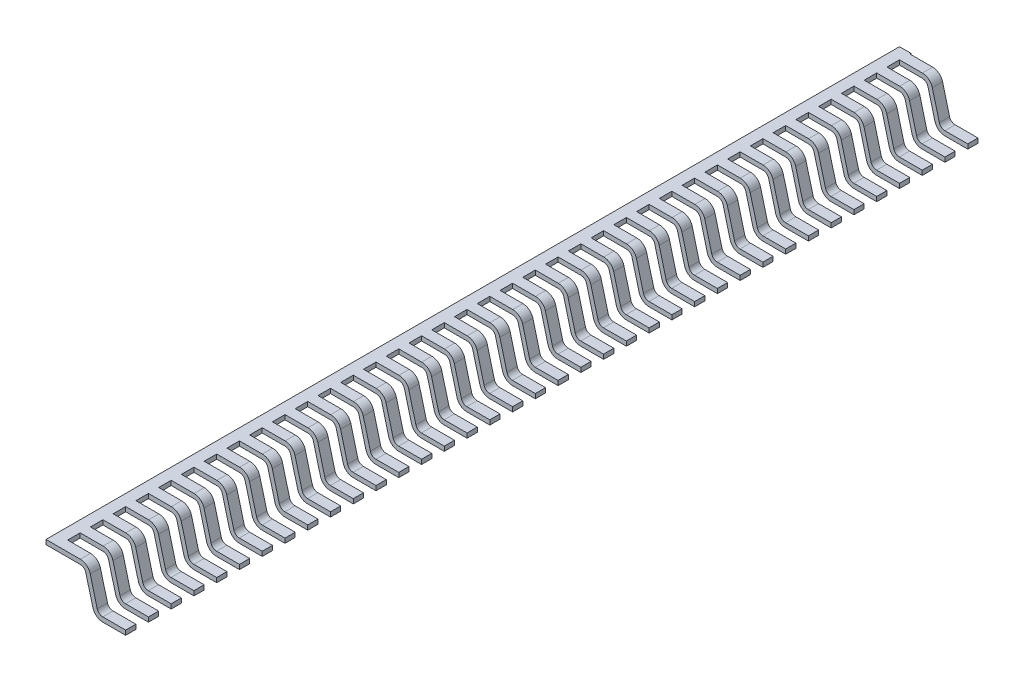
from build123d import *

# Parameters (mm, degrees)
EXTRUDE1_DEPTH  = 0.2286
SKETCH2_W       = 0.254
SKETCH2_H       = 19.05
EXTRUDE3_DEPTH  = 0.1016
LPATTERN2_COUNT = 38
LPATTERN2_PITCH = 0.508


with BuildPart() as part:
    # Sketch1 → Extrude1 (new body)
    with BuildSketch(Plane.XY):
        with BuildLine():
            Line((-0.127877099, 0.286320649), (0.029622326, -0.312177168))
            ThreePointArc((0.029622326, -0.312177168), (0.111127196, -0.435048696), (0.250695566, -0.4826))
            Line((0.250695566, -0.4826), (0.762, -0.4826))
            Line((0.762, -0.4826), (0.762, -0.381))
            Line((0.762, -0.381), (0.250695566, -0.381))
            ThreePointArc((0.250695566, -0.381), (0.173157583, -0.354582609), (0.127877099, -0.286320649))
            Line((0.127877099, -0.286320649), (-0.029622326, 0.312177168))
            ThreePointArc((-0.029622326, 0.312177168), (-0.111127196, 0.435048696), (-0.250695566, 0.4826))
            Line((-0.250695566, 0.4826), (-0.762, 0.4826))
            Line((-0.762, 0.4826), (-0.762, 0.381))
            Line((-0.762, 0.381), (-0.250695566, 0.381))
            ThreePointArc((-0.250695566, 0.381), (-0.173157583, 0.354582609), (-0.127877099, 0.286320649))
        make_face()
    extrude1 = extrude(amount=EXTRUDE1_DEPTH)

    # Sketch2 → Extrude3 (add)
    with BuildSketch(Plane(origin=(0, 0.4826, 0), x_dir=(-1, 0, 0), z_dir=(0, 1, 0))):
        with Locations((0.889, -9.2964)):
            Rectangle(SKETCH2_W, SKETCH2_H)
    extrude(amount=-EXTRUDE3_DEPTH)

    # LPattern2: Extrude1 ×38
    with Locations(*[(0, 0, -i * LPATTERN2_PITCH) for i in range(1, LPATTERN2_COUNT)]):
        add(extrude1)


solid = part.part
